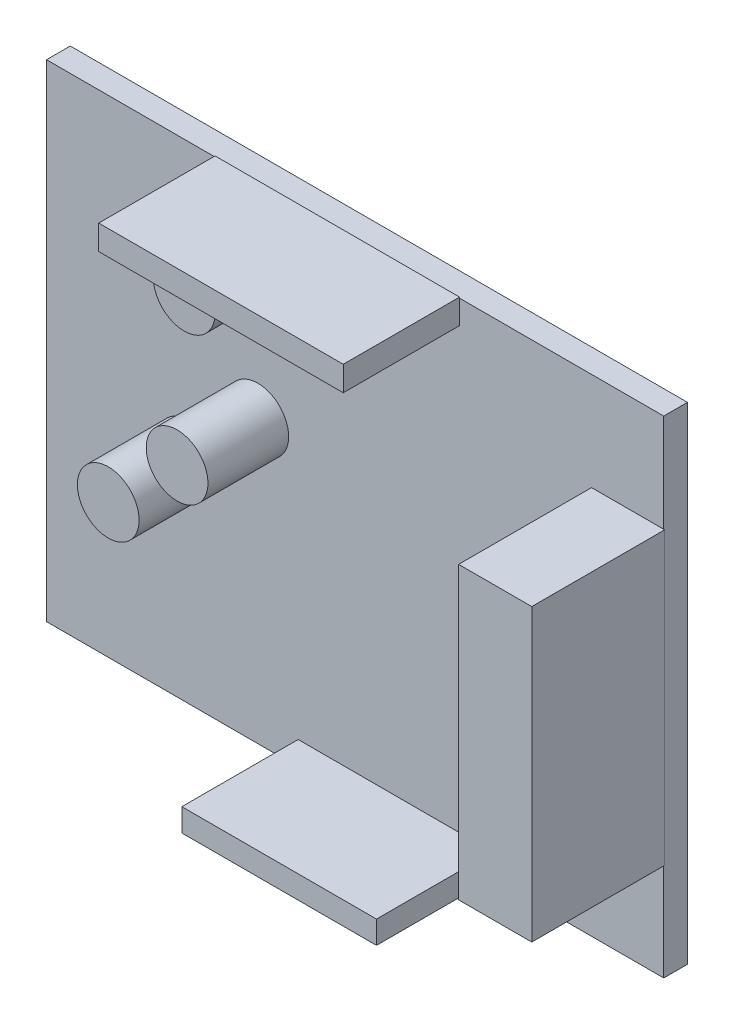
from build123d import *

# Parameters (mm, degrees)
SKETCH1_R            = 3.25
BOSS_EXTRUDE1_DEPTH  = 8.5
SKETCH3_W            = 65
SKETCH3_H            = 51.25
BOSS_EXTRUDE2_DEPTH  = 2.5
SKETCH4_W            = 7.6
SKETCH4_H            = 30.6
BOSS_EXTRUDE3_DEPTH  = 14
SKETCH5_R            = 3.25
BOSS_EXTRUDE4_DEPTH  = 8.5
SKETCH6_W            = 25.75
SKETCH6_H            = 2.5
BOSS_EXTRUDE5_DEPTH  = 12.25
SKETCH8_R            = 3.25
BOSS_EXTRUDE9_DEPTH  = 8.5
SKETCH9_W            = 20.5
SKETCH9_H            = 2.5
BOSS_EXTRUDE10_DEPTH = 12.25
SKETCH10_W           = 20.5
SKETCH10_H           = 12.25
CUT_EXTRUDE1_DEPTH   = 0.1
SKETCH12_W           = 25.75
SKETCH12_H           = 12.25
BOSS_EXTRUDE11_DEPTH = 0.1
SKETCH14_W           = 14
SKETCH14_H           = 30.6
BOSS_EXTRUDE12_DEPTH = 0.1


with BuildPart() as part:
    # Sketch1 → Boss-Extrude1 (new body)
    with BuildSketch(Plane.XY):
        with Locations((-17.5, -3)):
            Circle(SKETCH1_R)
    extrude(amount=BOSS_EXTRUDE1_DEPTH)

    # Sketch3 → Boss-Extrude2 (add)
    with BuildSketch(Plane.XY):
        Rectangle(SKETCH3_W, SKETCH3_H)
    extrude(amount=-BOSS_EXTRUDE2_DEPTH)

    # Sketch4 → Boss-Extrude3 (add)
    with BuildSketch(Plane.XY):
        with Locations((28.7, 0)):
            Rectangle(SKETCH4_W, SKETCH4_H)
    extrude(amount=BOSS_EXTRUDE3_DEPTH)

    # Sketch5 → Boss-Extrude4 (add)
    with BuildSketch(Plane.XY):
        with Locations((-10.25, 4)):
            Circle(SKETCH5_R)
    extrude(amount=BOSS_EXTRUDE4_DEPTH)

    # Sketch6 → Boss-Extrude5 (add)
    with BuildSketch(Plane.XY):
        with Locations((-1.875, 24.375)):
            Rectangle(SKETCH6_W, SKETCH6_H)
    extrude(amount=BOSS_EXTRUDE5_DEPTH)

    # Sketch8 → Boss-Extrude9 (add)
    with BuildSketch(Plane.XY):
        with Locations((-9.5, 19.87)):
            Circle(SKETCH8_R)
    extrude(amount=BOSS_EXTRUDE9_DEPTH)

    # Sketch9 → Boss-Extrude10 (add)
    with BuildSketch(Plane.XY):
        with Locations((4.25, -24.375)):
            Rectangle(SKETCH9_W, SKETCH9_H)
    extrude(amount=BOSS_EXTRUDE10_DEPTH)

    # Sketch10 → Cut-Extrude1 (cut)
    with BuildSketch(Plane.XZ.offset(25.625)):
        with Locations((4.25, 6.125)):
            Rectangle(SKETCH10_W, SKETCH10_H)
    extrude(amount=-CUT_EXTRUDE1_DEPTH, mode=Mode.SUBTRACT)

    # Sketch12 → Boss-Extrude11 (add)
    with BuildSketch(Plane(origin=(0, 25.625, 0), x_dir=(1, 0, 0), z_dir=(0, 1, 0))):
        with Locations((-1.875, -6.125)):
            Rectangle(SKETCH12_W, SKETCH12_H)
    extrude(amount=BOSS_EXTRUDE11_DEPTH)

    # Sketch14 → Boss-Extrude12 (add)
    with BuildSketch(Plane(origin=(32.5, 0, 0), x_dir=(0, 0, -1), z_dir=(1, 0, 0))):
        with Locations((-7, 0)):
            Rectangle(SKETCH14_W, SKETCH14_H)
    extrude(amount=BOSS_EXTRUDE12_DEPTH)


solid = part.part
